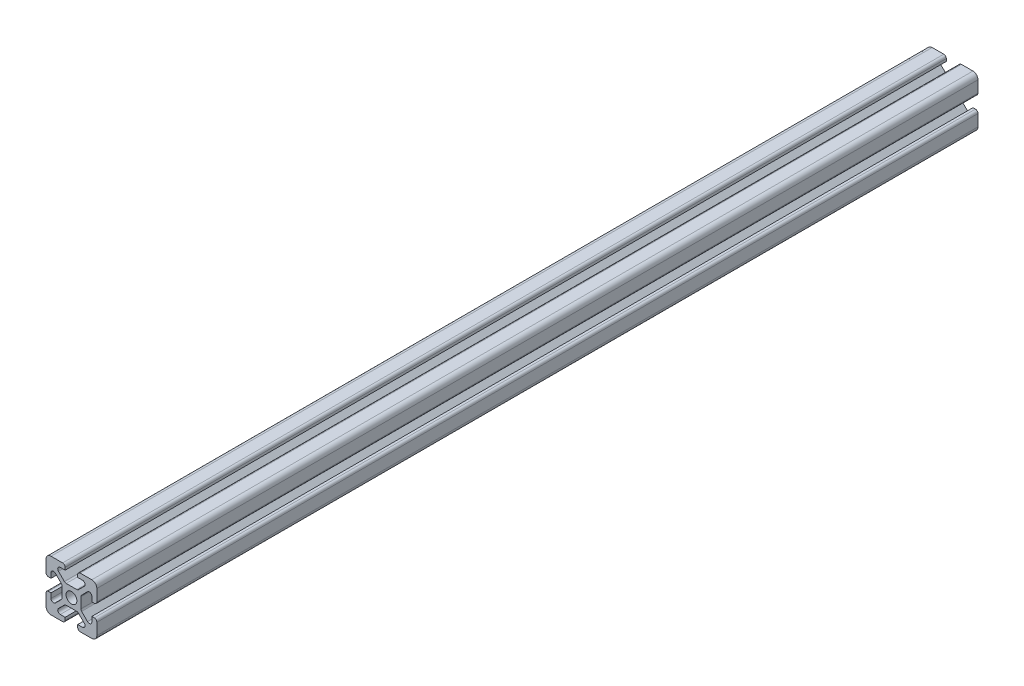
from build123d import *

# Parameters (mm, degrees)
SKETCH1_R           = 2.15
BOSS_EXTRUDE1_DEPTH = 350


with BuildPart() as part:
    # Sketch1 → Boss-Extrude1 (new body)
    with BuildSketch(Plane.XY):
        with BuildLine():
            Line((2, 0), (6.6, 0))
            ThreePointArc((6.6, 0), (7.307106781, 0.292893219), (7.6, 1))
            Line((7.6, 1), (7.6, 2))
            Line((7.6, 2), (5.664213562, 2))
            ThreePointArc((5.664213562, 2), (4.74033403, 2.617316568), (4.957106781, 3.707106781))
            Line((4.957106781, 3.707106781), (7.307106781, 6.057106781))
            ThreePointArc((7.307106781, 6.057106781), (7.63153013, 6.273879533), (8.014213562, 6.35))
            Line((8.014213562, 6.35), (12.185786438, 6.35))
            ThreePointArc((12.185786438, 6.35), (12.56846987, 6.273879533), (12.892893219, 6.057106781))
            Line((12.892893219, 6.057106781), (15.242893219, 3.707106781))
            ThreePointArc((15.242893219, 3.707106781), (15.45966597, 2.617316568), (14.535786438, 2))
            Line((14.535786438, 2), (12.6, 2))
            Line((12.6, 2), (12.6, 1))
            ThreePointArc((12.6, 1), (12.892893219, 0.292893219), (13.6, 0))
            Line((13.6, 0), (18.2, 0))
            ThreePointArc((18.2, 0), (19.614213562, 0.585786438), (20.2, 2))
            Line((20.2, 2), (20.2, 6.6))
            ThreePointArc((20.2, 6.6), (19.907106781, 7.307106781), (19.2, 7.6))
            Line((19.2, 7.6), (18.2, 7.6))
            Line((18.2, 7.6), (18.2, 5.664213562))
            ThreePointArc((18.2, 5.664213562), (17.582683432, 4.74033403), (16.492893219, 4.957106781))
            Line((16.492893219, 4.957106781), (14.142893219, 7.307106781))
            ThreePointArc((14.142893219, 7.307106781), (13.926120467, 7.63153013), (13.85, 8.014213562))
            Line((13.85, 8.014213562), (13.85, 12.185786438))
            ThreePointArc((13.85, 12.185786438), (13.926120467, 12.56846987), (14.142893219, 12.892893219))
            Line((14.142893219, 12.892893219), (16.492893219, 15.242893219))
            ThreePointArc((16.492893219, 15.242893219), (17.582683432, 15.45966597), (18.2, 14.535786438))
            Line((18.2, 14.535786438), (18.2, 12.6))
            Line((18.2, 12.6), (19.2, 12.6))
            ThreePointArc((19.2, 12.6), (19.907106781, 12.892893219), (20.2, 13.6))
            Line((20.2, 13.6), (20.2, 18.2))
            ThreePointArc((20.2, 18.2), (19.614213562, 19.614213562), (18.2, 20.2))
            Line((18.2, 20.2), (13.6, 20.2))
            ThreePointArc((13.6, 20.2), (12.892893219, 19.907106781), (12.6, 19.2))
            Line((12.6, 19.2), (12.6, 18.2))
            Line((12.6, 18.2), (14.535786438, 18.2))
            ThreePointArc((14.535786438, 18.2), (15.45966597, 17.582683432), (15.242893219, 16.492893219))
            Line((15.242893219, 16.492893219), (12.892893219, 14.142893219))
            ThreePointArc((12.892893219, 14.142893219), (12.56846987, 13.926120467), (12.185786438, 13.85))
            Line((12.185786438, 13.85), (8.014213562, 13.85))
            ThreePointArc((8.014213562, 13.85), (7.63153013, 13.926120467), (7.307106781, 14.142893219))
            Line((7.307106781, 14.142893219), (4.957106781, 16.492893219))
            ThreePointArc((4.957106781, 16.492893219), (4.74033403, 17.582683432), (5.664213562, 18.2))
            Line((5.664213562, 18.2), (7.6, 18.2))
            Line((7.6, 18.2), (7.6, 19.2))
            ThreePointArc((7.6, 19.2), (7.307106781, 19.907106781), (6.6, 20.2))
            Line((6.6, 20.2), (2, 20.2))
            ThreePointArc((2, 20.2), (0.585786438, 19.614213562), (0, 18.2))
            Line((0, 18.2), (0, 13.6))
            ThreePointArc((0, 13.6), (0.292893219, 12.892893219), (1, 12.6))
            Line((1, 12.6), (2, 12.6))
            Line((2, 12.6), (2, 14.535786438))
            ThreePointArc((2, 14.535786438), (2.617316568, 15.45966597), (3.707106781, 15.242893219))
            Line((3.707106781, 15.242893219), (6.057106781, 12.892893219))
            ThreePointArc((6.057106781, 12.892893219), (6.273879533, 12.56846987), (6.35, 12.185786438))
            Line((6.35, 12.185786438), (6.35, 8.014213562))
            ThreePointArc((6.35, 8.014213562), (6.273879533, 7.63153013), (6.057106781, 7.307106781))
            Line((6.057106781, 7.307106781), (3.707106781, 4.957106781))
            ThreePointArc((3.707106781, 4.957106781), (2.617316568, 4.74033403), (2, 5.664213562))
            Line((2, 5.664213562), (2, 7.6))
            Line((2, 7.6), (1, 7.6))
            ThreePointArc((1, 7.6), (0.292893219, 7.307106781), (0, 6.6))
            Line((0, 6.6), (0, 2))
            ThreePointArc((0, 2), (0.585786438, 0.585786438), (2, 0))
        make_face()
        with Locations((10.1, 10)):
            Circle(SKETCH1_R, mode=Mode.SUBTRACT)
    extrude(amount=BOSS_EXTRUDE1_DEPTH)


solid = part.part
